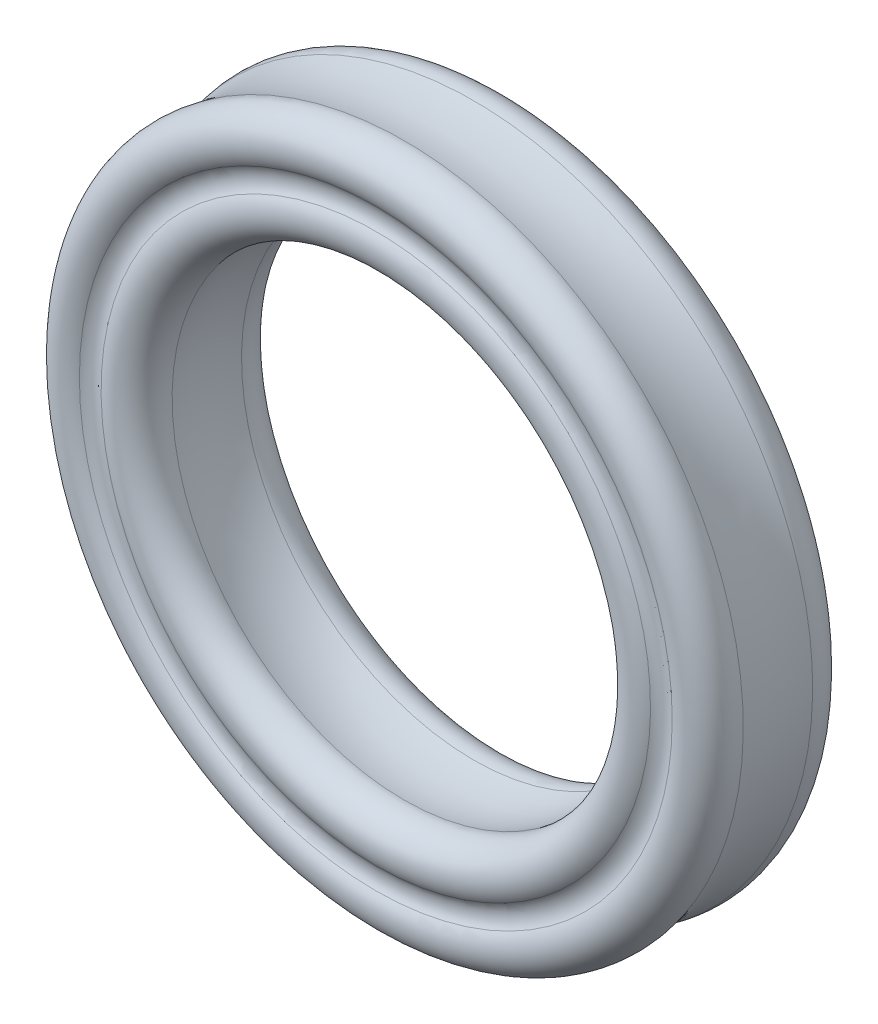
from build123d import *


with BuildPart() as part:
    # Esquisse1 → Base-Révolution (revolve)
    with BuildSketch(Plane(origin=(0, 0, 0), x_dir=(0, 0, -1), z_dir=(1, 0, 0))):
        with BuildLine():
            ThreePointArc((0.494780793, 4.937189473), (0.067072284, 4.775200846), (0.079, 4.318))
            ThreePointArc((0.079, 4.318), (0.131666667, 4.16), (0.079, 4.002))
            ThreePointArc((0.079, 4.002), (0.067072284, 3.544799154), (0.494780793, 3.382810527))
            ThreePointArc((0.494780793, 3.382810527), (1, 3.447673955), (1.505219207, 3.382810527))
            ThreePointArc((1.505219207, 3.382810527), (1.932927716, 3.544799154), (1.921, 4.002))
            ThreePointArc((1.921, 4.002), (1.868333333, 4.16), (1.921, 4.318))
            ThreePointArc((1.921, 4.318), (1.932927716, 4.775200846), (1.505219207, 4.937189473))
            ThreePointArc((1.505219207, 4.937189473), (1, 4.872326045), (0.494780793, 4.937189473))
        make_face()
    revolve(axis=Axis((0, 0, 0), (0, 0, -1)))


solid = part.part
